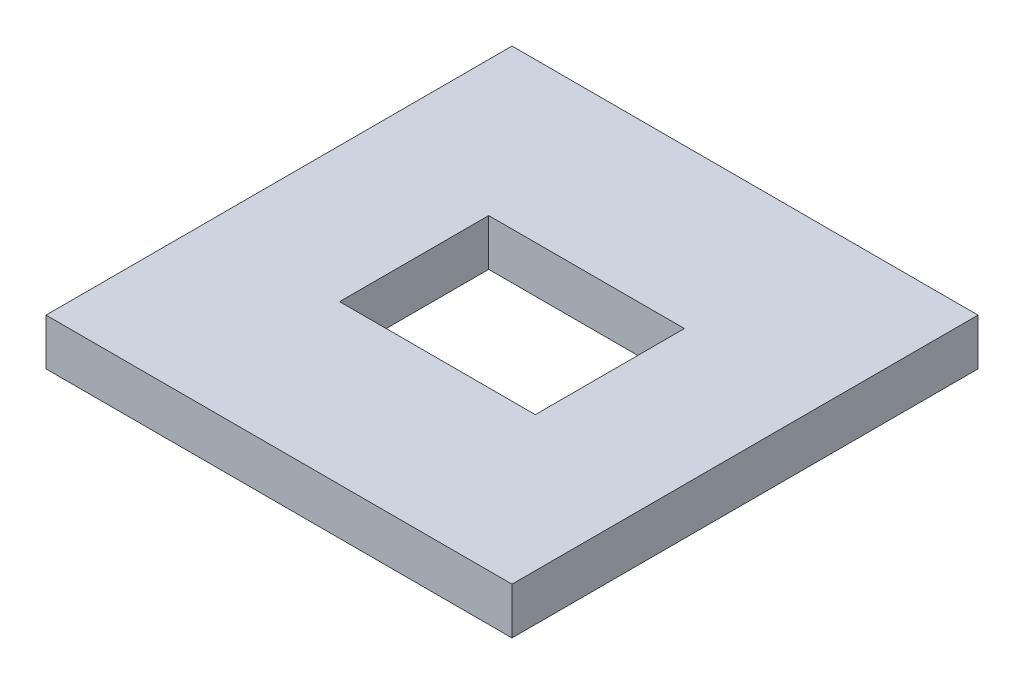
from build123d import *

# Parameters (mm, degrees)
SKETCH1_W           = 50
SKETCH1_H           = 50
SKETCH1_W_2         = 21
SKETCH1_H_2         = 16
BOSS_EXTRUDE1_DEPTH = 5


with BuildPart() as part:
    # Sketch1 → Boss-Extrude1 (new body)
    with BuildSketch(Plane(origin=(0, 0, 0), x_dir=(1, 0, 0), z_dir=(0, 1, 0))):
        Rectangle(SKETCH1_W, SKETCH1_H)
        Rectangle(SKETCH1_W_2, SKETCH1_H_2, mode=Mode.SUBTRACT)
    extrude(amount=BOSS_EXTRUDE1_DEPTH)


solid = part.part
